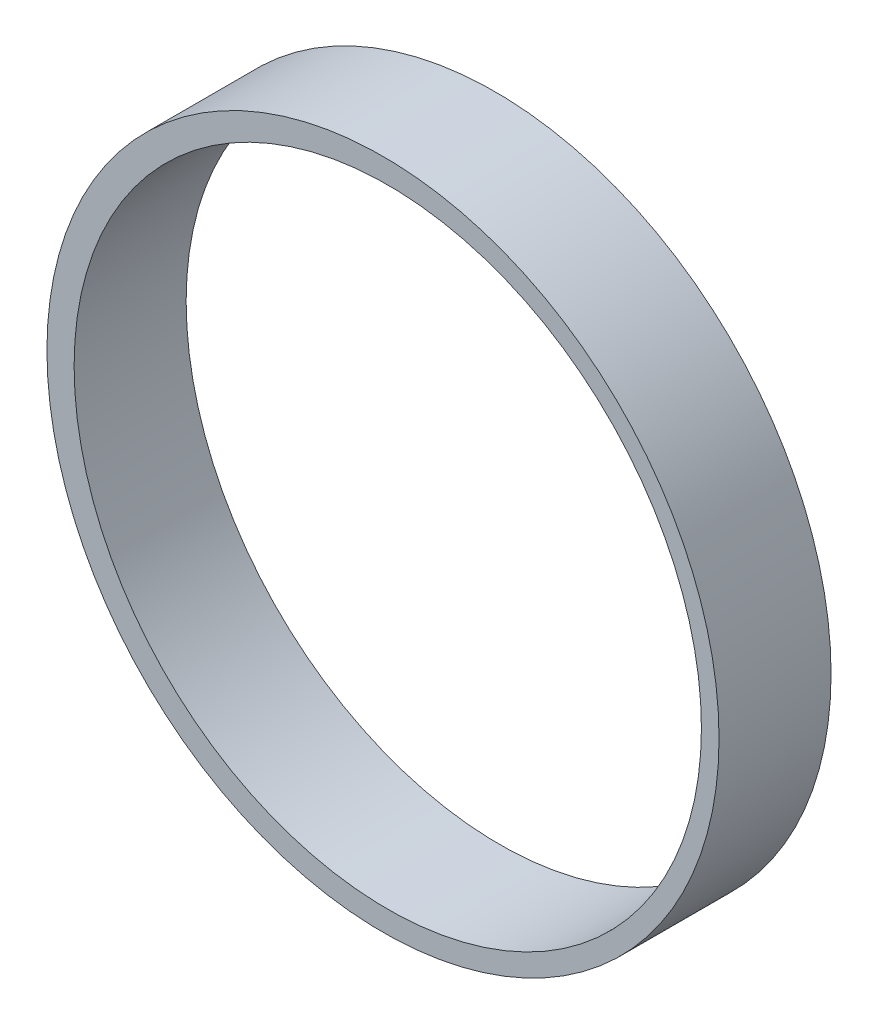
from build123d import *

# Parameters (mm, degrees)
SKIZZE1_R                       = 15
AUFSATZ_LINEAR_AUSTRAGEN1_DEPTH = 5
SKIZZE2_R                       = 14
SCHNITT_LINEAR_AUSTRAGEN1_DEPTH = 5


with BuildPart() as part:
    # Skizze1 → Aufsatz-Linear austragen1 (new body)
    with BuildSketch(Plane.XY):
        Circle(SKIZZE1_R)
    extrude(amount=AUFSATZ_LINEAR_AUSTRAGEN1_DEPTH)

    # Skizze2 → Schnitt-Linear austragen1 (cut)
    with BuildSketch(Plane.XY.offset(5)):
        with Locations((0.213293684, 0)):
            Circle(SKIZZE2_R)
    extrude(amount=-SCHNITT_LINEAR_AUSTRAGEN1_DEPTH, mode=Mode.SUBTRACT)


solid = part.part
